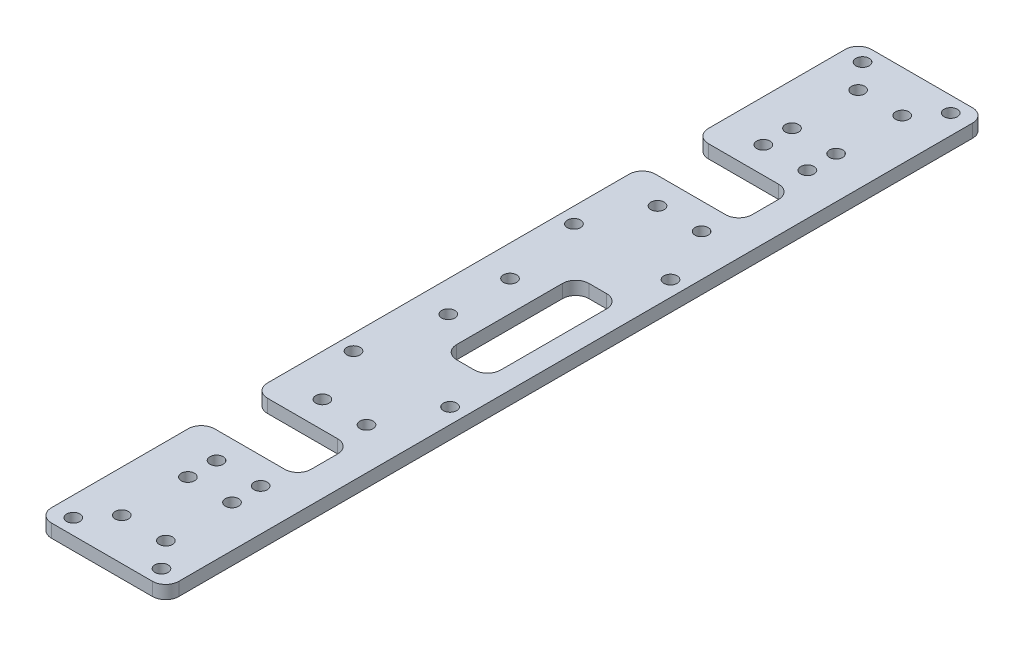
from build123d import *

# Parameters (mm, degrees)
SKETCH_1_W          = 28.9
SKETCH_1_H          = 186
EXTRUDE_1_DEPTH     = 3
FILLET_1_R          = 3
SKETCH_2_R          = 1.5
SKETCH_2_W          = 21.9
SKETCH_2_H          = 12
CUT_EXTRUDE_1_DEPTH = 3
FILLET_2_R          = 3
SKETCH_3_W          = 10
SKETCH_3_H          = 30
CUT_EXTRUDE_2_DEPTH = 3
FILLET_3_R          = 3


with BuildPart() as part:
    # 草图1 → 凸台-拉伸1 (new body)
    with BuildSketch(Plane(origin=(0, 0, 0), x_dir=(1, 0, 0), z_dir=(0, 1, 0))):
        Rectangle(SKETCH_1_W, SKETCH_1_H)
    extrude(amount=EXTRUDE_1_DEPTH)

    # 圆角1
    fillet_1_edges = [part.edges().sort_by_distance(p)[0] for p in [
        (14.45, 1.5, -93),
        (-14.45, 1.5, -93),
        (-14.45, 1.5, 93),
        (14.45, 1.5, 93),
    ]]
    fillet(fillet_1_edges, radius=FILLET_1_R)

    # 草图2 → 切除-拉伸1 (cut)
    with BuildSketch(Plane(origin=(0, 3, 0), x_dir=(1, 0, 0), z_dir=(0, 1, 0))):
        with Locations((10, -89.5)):
            Circle(SKETCH_2_R)
        with Locations((-10, -89.5)):
            Circle(SKETCH_2_R)
        with Locations((-10, 89.5)):
            Circle(SKETCH_2_R)
        with Locations((10, 89.5)):
            Circle(SKETCH_2_R)
        with Locations((-5, -38)):
            Circle(SKETCH_2_R)
        with Locations((-5, -62)):
            Circle(SKETCH_2_R)
        with Locations((5, -38)):
            Circle(SKETCH_2_R)
        with Locations((5, -62)):
            Circle(SKETCH_2_R)
        with Locations((5, 62)):
            Circle(SKETCH_2_R)
        with Locations((-5, 62)):
            Circle(SKETCH_2_R)
        with Locations((5, 38)):
            Circle(SKETCH_2_R)
        with Locations((-5, 38)):
            Circle(SKETCH_2_R)
        with Locations((-7.45, 7)):
            Circle(SKETCH_2_R)
        with Locations((-7.45, -7)):
            Circle(SKETCH_2_R)
        with Locations((-5, -68.5)):
            Circle(SKETCH_2_R)
        with Locations((-5, -83.5)):
            Circle(SKETCH_2_R)
        with Locations((5, -83.5)):
            Circle(SKETCH_2_R)
        with Locations((5, -68.5)):
            Circle(SKETCH_2_R)
        with Locations((5, 83.5)):
            Circle(SKETCH_2_R)
        with Locations((-5, 83.5)):
            Circle(SKETCH_2_R)
        with Locations((5, 68.5)):
            Circle(SKETCH_2_R)
        with Locations((-5, 68.5)):
            Circle(SKETCH_2_R)
        with Locations((10.95, 25)):
            Circle(SKETCH_2_R)
        with Locations((10.95, -25)):
            Circle(SKETCH_2_R)
        with Locations((-10.95, -25)):
            Circle(SKETCH_2_R)
        with Locations((-10.95, 25)):
            Circle(SKETCH_2_R)
        with Locations((-3.5, 50)):
            Rectangle(SKETCH_2_W, SKETCH_2_H)
        with Locations((-3.5, -50)):
            Rectangle(SKETCH_2_W, SKETCH_2_H)
    extrude(amount=-CUT_EXTRUDE_1_DEPTH, mode=Mode.SUBTRACT)

    # 圆角2
    fillet_2_edges = [part.edges().sort_by_distance(p)[0] for p in [
        (-14.45, 1.5, 56),
        (-14.45, 1.5, 44),
        (-14.45, 1.5, -44),
        (-14.45, 1.5, -56),
        (7.45, 1.5, 56),
        (7.45, 1.5, 44),
        (7.45, 1.5, -44),
        (7.45, 1.5, -56),
    ]]
    fillet(fillet_2_edges, radius=FILLET_2_R)

    # 草图3 → 切除-拉伸2 (cut)
    with BuildSketch(Plane(origin=(0, 3, 0), x_dir=(1, 0, 0), z_dir=(0, 1, 0))):
        with Locations((4.45, 0)):
            Rectangle(SKETCH_3_W, SKETCH_3_H)
    extrude(amount=-CUT_EXTRUDE_2_DEPTH, mode=Mode.SUBTRACT)

    # 圆角3
    fillet_3_edges = [part.edges().sort_by_distance(p)[0] for p in [
        (-0.55, 1.5, 15),
        (9.45, 1.5, 15),
        (9.45, 1.5, -15),
        (-0.55, 1.5, -15),
    ]]
    fillet(fillet_3_edges, radius=FILLET_3_R)


solid = part.part
